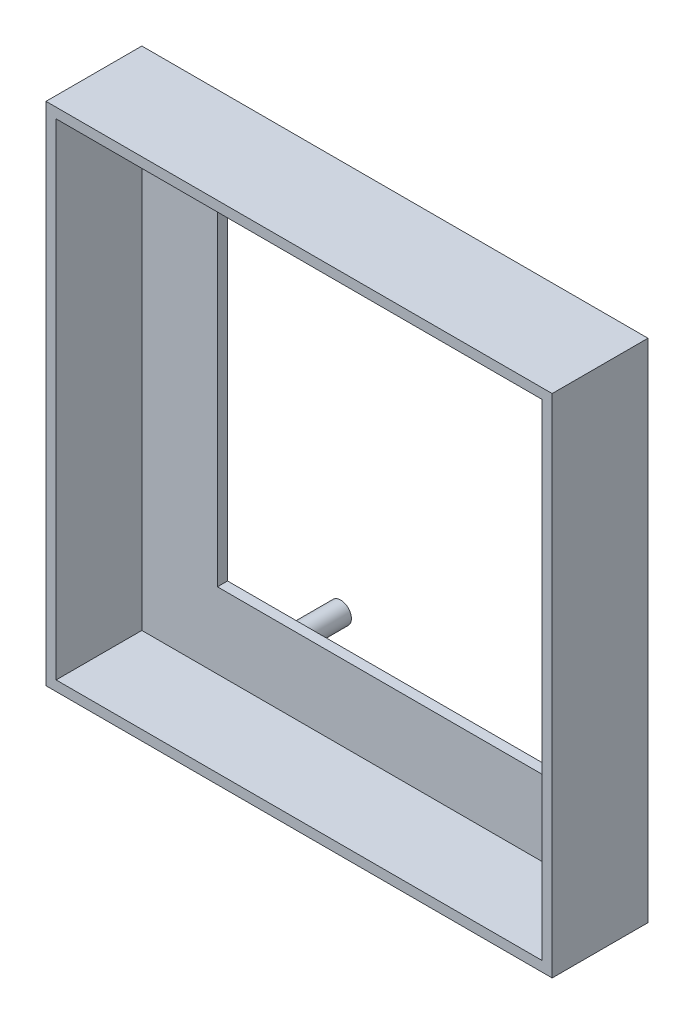
from build123d import *

# Parameters (mm, degrees)
CROQUIS2_W              = 150
CROQUIS2_H              = 150
CROQUIS2_W_2            = 99.2
CROQUIS2_H_2            = 99.2
SALIENTE_EXTRUIR1_DEPTH = 3
CROQUIS5_W              = 150
CROQUIS5_H              = 150
CROQUIS5_W_2            = 144
CROQUIS5_H_2            = 144
SALIENTE_EXTRUIR2_DEPTH = 25.4
CROQUIS6_R              = 3.175
SALIENTE_EXTRUIR3_DEPTH = 15


with BuildPart() as part:
    # Croquis2 → Saliente-Extruir1 (new body)
    with BuildSketch(Plane.XY):
        Rectangle(CROQUIS2_W, CROQUIS2_H)
        Rectangle(CROQUIS2_W_2, CROQUIS2_H_2, mode=Mode.SUBTRACT)
    extrude(amount=SALIENTE_EXTRUIR1_DEPTH)

    # Croquis5 → Saliente-Extruir2 (add)
    with BuildSketch(Plane.XY.offset(3)):
        Rectangle(CROQUIS5_W, CROQUIS5_H)
        Rectangle(CROQUIS5_W_2, CROQUIS5_H_2, mode=Mode.SUBTRACT)
    extrude(amount=SALIENTE_EXTRUIR2_DEPTH)

    # Croquis6 → Saliente-Extruir3 (add)
    with BuildSketch(Plane(origin=(0, 0, 0), x_dir=(-1, 0, 0), z_dir=(0, 0, -1))):
        with Locations(Location((31.07, -55.9, 0), (0, 0, 180))):
            Circle(CROQUIS6_R)
    extrude(amount=SALIENTE_EXTRUIR3_DEPTH)


solid = part.part
